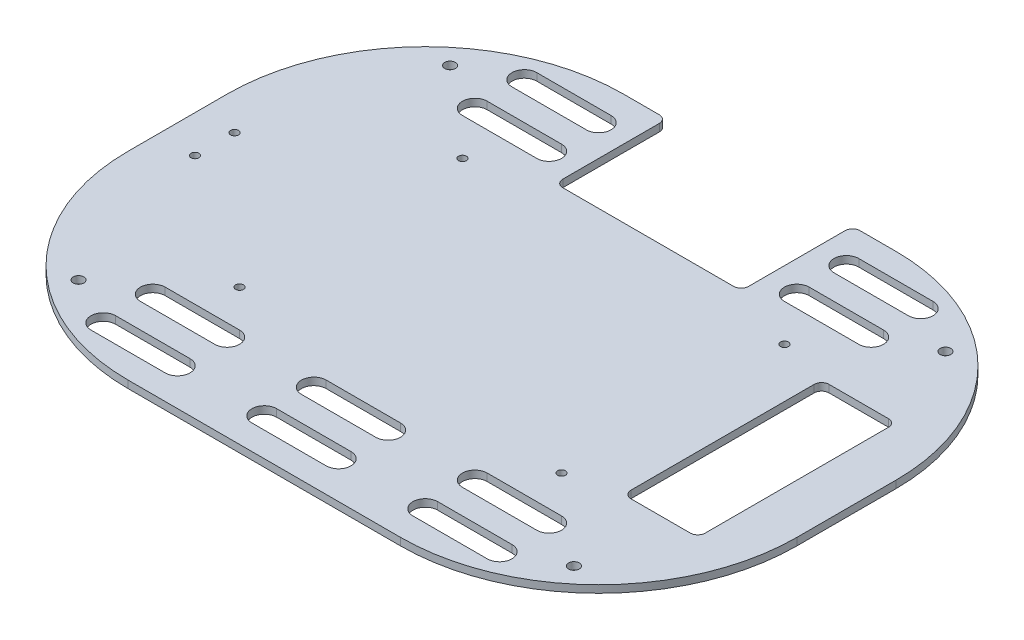
from build123d import *

# Parameters (mm, degrees)
SKETCH_1_W          = 270
SKETCH_1_H          = 200
EXTRUDE_1_DEPTH     = 3
SKETCH_2_R          = 2.15
CUT_EXTRUDE_1_DEPTH = 3
SKETCH_3_R          = 1.6
CUT_EXTRUDE_2_DEPTH = 3
SKETCH_4_W          = 75
SKETCH_4_H          = 45
CUT_EXTRUDE_3_DEPTH = 3
SKETCH_5_R          = 1.6
CUT_EXTRUDE_4_DEPTH = 3
SKETCH_6_W          = 30
SKETCH_6_H          = 80
CUT_EXTRUDE_5_DEPTH = 3
CUT_EXTRUDE_6_DEPTH = 3
FILLET_1_R          = 3


with BuildPart() as part:
    # 草图1 → 凸台-拉伸1 (new body)
    with BuildSketch(Plane(origin=(0, 0, 0), x_dir=(1, 0, 0), z_dir=(0, 1, 0))):
        Rectangle(SKETCH_1_W, SKETCH_1_H)
    extrude(amount=EXTRUDE_1_DEPTH)

    # 草图2 → 切除-拉伸1 (cut)
    with BuildSketch(Plane(origin=(0, 3, 0), x_dir=(1, 0, 0), z_dir=(0, 1, 0))):
        with Locations(Location((-100, 75, 0), (0, 0, 270))):
            Circle(SKETCH_2_R)
        with Locations(Location((100, 75, 0), (0, 0, 270))):
            Circle(SKETCH_2_R)
        with Locations(Location((100, -75, 0), (0, 0, 270))):
            Circle(SKETCH_2_R)
        with Locations(Location((-100, -75, 0), (0, 0, 270))):
            Circle(SKETCH_2_R)
    extrude(amount=-CUT_EXTRUDE_1_DEPTH, mode=Mode.SUBTRACT)

    # 草图3 → 切除-拉伸2 (cut)
    with BuildSketch(Plane(origin=(0, 3, 0), x_dir=(1, 0, 0), z_dir=(0, 1, 0))):
        with Locations(Location((-120, 8, 0), (0, 0, 270))):
            Circle(SKETCH_3_R)
        with Locations(Location((-120, -8, 0), (0, 0, 270))):
            Circle(SKETCH_3_R)
    extrude(amount=-CUT_EXTRUDE_2_DEPTH, mode=Mode.SUBTRACT)

    # 草图4 → 切除-拉伸3 (cut)
    with BuildSketch(Plane(origin=(0, 3, 0), x_dir=(1, 0, 0), z_dir=(0, 1, 0))):
        with BuildLine():
            Line((-80, -80), (-50, -80))
            ThreePointArc((-50, -80), (-45, -85), (-50, -90))
            Line((-50, -90), (-80, -90))
            ThreePointArc((-80, -90), (-85, -85), (-80, -80))
        make_face()
        with BuildLine():
            Line((-15, -80), (15, -80))
            ThreePointArc((15, -80), (20, -85), (15, -90))
            Line((15, -90), (-15, -90))
            ThreePointArc((-15, -90), (-20, -85), (-15, -80))
        make_face()
        with BuildLine():
            Line((50, -80), (80, -80))
            ThreePointArc((80, -80), (85, -85), (80, -90))
            Line((80, -90), (50, -90))
            ThreePointArc((50, -90), (45, -85), (50, -80))
        make_face()
        with BuildLine():
            Line((-15, -60), (15, -60))
            ThreePointArc((15, -60), (20, -65), (15, -70))
            Line((15, -70), (-15, -70))
            ThreePointArc((-15, -70), (-20, -65), (-15, -60))
        make_face()
        with BuildLine():
            Line((50, -60), (80, -60))
            ThreePointArc((80, -60), (85, -65), (80, -70))
            Line((80, -70), (50, -70))
            ThreePointArc((50, -70), (45, -65), (50, -60))
        make_face()
        with BuildLine():
            Line((-80, -60), (-50, -60))
            ThreePointArc((-50, -60), (-45, -65), (-50, -70))
            Line((-50, -70), (-80, -70))
            ThreePointArc((-80, -70), (-85, -65), (-80, -60))
        make_face()
        with BuildLine():
            Line((-80, 80), (-50, 80))
            ThreePointArc((-50, 80), (-45, 85), (-50, 90))
            Line((-50, 90), (-80, 90))
            ThreePointArc((-80, 90), (-85, 85), (-80, 80))
        make_face()
        with BuildLine():
            Line((50, 80), (80, 80))
            ThreePointArc((80, 80), (85, 85), (80, 90))
            Line((80, 90), (50, 90))
            ThreePointArc((50, 90), (45, 85), (50, 80))
        make_face()
        with BuildLine():
            Line((50, 60), (80, 60))
            ThreePointArc((80, 60), (85, 65), (80, 70))
            Line((80, 70), (50, 70))
            ThreePointArc((50, 70), (45, 65), (50, 60))
        make_face()
        with BuildLine():
            Line((-80, 60), (-50, 60))
            ThreePointArc((-50, 60), (-45, 65), (-50, 70))
            Line((-50, 70), (-80, 70))
            ThreePointArc((-80, 70), (-85, 65), (-80, 60))
        make_face()
        with Locations((0, 77.5)):
            Rectangle(SKETCH_4_W, SKETCH_4_H)
    extrude(amount=-CUT_EXTRUDE_3_DEPTH, mode=Mode.SUBTRACT)

    # 草图5 → 切除-拉伸4 (cut)
    with BuildSketch(Plane(origin=(0, 3, 0), x_dir=(1, 0, 0), z_dir=(0, 1, 0))):
        with Locations(Location((-65, -45, 0), (0, 0, 270))):
            Circle(SKETCH_5_R)
        with Locations(Location((-65, 45, 0), (0, 0, 270))):
            Circle(SKETCH_5_R)
        with Locations(Location((65, 45, 0), (0, 0, 270))):
            Circle(SKETCH_5_R)
        with Locations(Location((65, -45, 0), (0, 0, 270))):
            Circle(SKETCH_5_R)
    extrude(amount=-CUT_EXTRUDE_4_DEPTH, mode=Mode.SUBTRACT)

    # 草图6 → 切除-拉伸5 (cut)
    with BuildSketch(Plane(origin=(0, 3, 0), x_dir=(1, 0, 0), z_dir=(0, 1, 0))):
        with Locations((100, 0)):
            Rectangle(SKETCH_6_W, SKETCH_6_H)
    extrude(amount=-CUT_EXTRUDE_5_DEPTH, mode=Mode.SUBTRACT)

    # 草图7 → 切除-拉伸6 (cut)
    with BuildSketch(Plane(origin=(0, 3, 0), x_dir=(1, 0, 0), z_dir=(0, 1, 0))):
        with BuildLine():
            Line((-55, 100), (-135, 100))
            Line((-135, 100), (-135, 20))
            ThreePointArc((-135, 20), (-111.568542495, 76.568542495), (-55, 100))
        make_face()
        with BuildLine():
            Line((-135, -100), (-135, -20))
            ThreePointArc((-135, -20), (-111.568542495, -76.568542495), (-55, -100))
            Line((-55, -100), (-135, -100))
        make_face()
        with BuildLine():
            Line((55, -100), (135, -100))
            Line((135, -100), (135, -20))
            ThreePointArc((135, -20), (111.568542495, -76.568542495), (55, -100))
        make_face()
        with BuildLine():
            Line((135, 100), (135, 20))
            ThreePointArc((135, 20), (111.568542495, 76.568542495), (55, 100))
            Line((55, 100), (135, 100))
        make_face()
    extrude(amount=-CUT_EXTRUDE_6_DEPTH, mode=Mode.SUBTRACT)

    # 圆角1
    fillet_1_edges = [part.edges().sort_by_distance(p)[0] for p in [
        (-37.5, 1.5, -55),
        (-37.5, 1.5, -100),
        (37.5, 1.5, -100),
        (37.5, 1.5, -55),
        (115, 1.5, -40),
        (115, 1.5, 40),
        (85, 1.5, 40),
        (85, 1.5, -40),
    ]]
    fillet(fillet_1_edges, radius=FILLET_1_R)


solid = part.part
